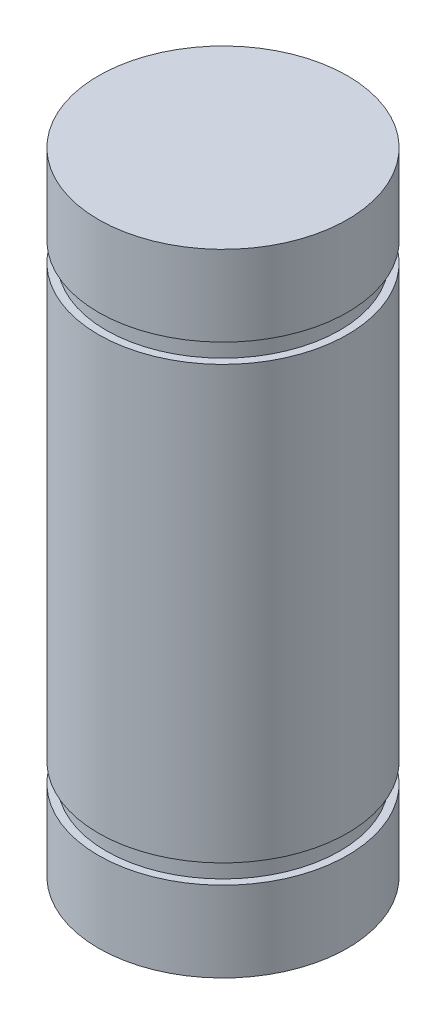
from build123d import *

# Parameters (mm, degrees)
BOSS_EXTRUDE1_DEPTH      = 8.255
BOSS_EXTRUDE1_DEPTH_BACK = 8.255
SKETCH1_R                = 4.7625
SKETCH2_R                = 4.7625
BOSS_EXTRUDE2_DEPTH      = 3.81
BOSS_EXTRUDE3_START      = 3.81
SKETCH3_R                = 4.7625
BOSS_EXTRUDE3_DEPTH      = 3.81
SKETCH4_R                = 5.08
CUT_EXTRUDE1_DEPTH       = 0.7366
SKETCH5_R                = 5.08
CUT_EXTRUDE2_DEPTH       = 0.7366
SKETCH6_R                = 4.4704
BOSS_EXTRUDE4_DEPTH      = 0.7366
SKETCH7_R                = 4.4704
BOSS_EXTRUDE5_DEPTH      = 0.7366


with BuildPart() as part:
    # Sketch1 → Boss-Extrude1 (new, two sides: drawn at the far end of the back side and taken through both)
    with BuildSketch(Plane(origin=(0, 0, 0), x_dir=(1, 0, 0), z_dir=(0, 1, 0)).offset(-BOSS_EXTRUDE1_DEPTH_BACK)):
        with Locations(Location((0, 0, 0), (0, 0, 270))):
            Circle(SKETCH1_R)
    extrude(amount=BOSS_EXTRUDE1_DEPTH + BOSS_EXTRUDE1_DEPTH_BACK)

    # Sketch2 → Boss-Extrude2 (add)
    with BuildSketch(Plane(origin=(0, 8.255, 0), x_dir=(1, 0, 0), z_dir=(0, 1, 0))):
        with Locations(Location((0, 0, 0), (0, 0, 270))):
            Circle(SKETCH2_R)
    extrude(amount=BOSS_EXTRUDE2_DEPTH)

    # Sketch3 → Boss-Extrude3 (add)
    with BuildSketch(Plane(origin=(0, -8.255, 0), x_dir=(-1, 0, 0), z_dir=(0, -1, 0)).offset(BOSS_EXTRUDE3_START)):
        with Locations(Location((0, 0, 0), (0, 0, 90))):
            Circle(SKETCH3_R)
    extrude(amount=-BOSS_EXTRUDE3_DEPTH)

    # Sketch4 → Cut-Extrude1 (cut)
    with BuildSketch(Plane(origin=(0, -8.9916, 0), x_dir=(-1, 0, 0), z_dir=(0, -1, 0))):
        Circle(SKETCH4_R)
    extrude(amount=-CUT_EXTRUDE1_DEPTH, mode=Mode.SUBTRACT)


with BuildPart() as cut_extrude1_piece_1:
    # of the separate pieces the step leaves, piece 1, a body of its own (cut_extrude1_pieces)
    add(part.part.solids().sort_by_distance((0, 12.065, 4.7625))[0])

    # Sketch5 → Cut-Extrude2 (cut)
    with BuildSketch(Plane(origin=(0, 8.9916, 0), x_dir=(1, 0, 0), z_dir=(0, 1, 0))):
        Circle(SKETCH5_R)
    extrude(amount=-CUT_EXTRUDE2_DEPTH, mode=Mode.SUBTRACT)


with BuildPart() as cut_extrude1_piece_2:
    # of the separate pieces the step leaves, piece 2, a body of its own (cut_extrude1_pieces)
    add(part.part.solids().sort_by_distance((0, -12.065, -4.7625))[0])



with BuildPart() as cut_extrude2_piece_1:
    # of the separate pieces the step leaves, piece 1, a body of its own (cut_extrude2_pieces)
    add(cut_extrude1_piece_1.part.solids().sort_by_distance((0, 8.255, 4.7625))[0])


with BuildPart() as cut_extrude2_piece_2:
    # of the separate pieces the step leaves, piece 2, a body of its own (cut_extrude2_pieces)
    add(cut_extrude1_piece_1.part.solids().sort_by_distance((0, 12.065, 4.7625))[0])


with BuildPart() as cut_extrude1_piece_2_1:
    add(cut_extrude1_piece_2.part)

    add(cut_extrude2_piece_1.part)  # Boss-Extrude4 merges Cut-Extrude2 piece 1
    # Sketch6 → Boss-Extrude4 (add)
    with BuildSketch(Plane(origin=(0, -8.9916, 0), x_dir=(1, 0, 0), z_dir=(0, 1, 0))):
        with Locations(Location((0, 0, 0), (0, 0, 90))):
            Circle(SKETCH6_R)
    extrude(amount=BOSS_EXTRUDE4_DEPTH)


    add(cut_extrude2_piece_2.part)  # Boss-Extrude5 merges Cut-Extrude2 piece 2
    # Sketch7 → Boss-Extrude5 (add)
    with BuildSketch(Plane(origin=(0, 8.255, 0), x_dir=(1, 0, 0), z_dir=(0, 1, 0))):
        with Locations(Location((0, 0, 0), (0, 0, 270))):
            Circle(SKETCH7_R)
    extrude(amount=BOSS_EXTRUDE5_DEPTH)


solid = cut_extrude1_piece_2_1.part
